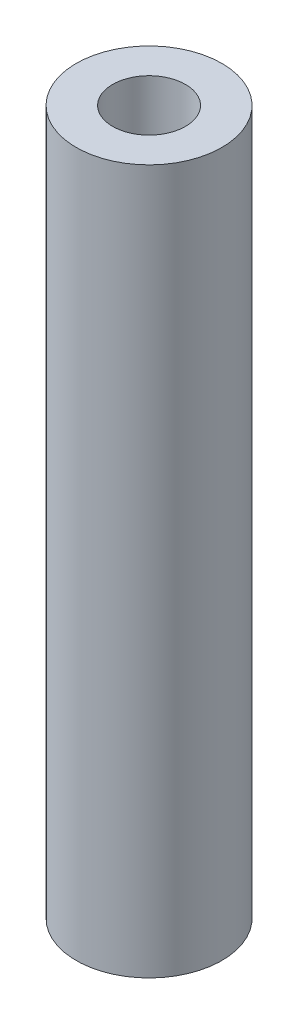
from build123d import *

# Parameters (mm, degrees)
SKETCH1_R      = 3
SKETCH1_R_2    = 1.5
STANDOFF_DEPTH = 29


with BuildPart() as part:
    # Sketch1 → standoff (new body)
    with BuildSketch(Plane(origin=(0, 0, 0), x_dir=(1, 0, 0), z_dir=(0, 1, 0))):
        with Locations(Location((0, 0, 0), (0, 0, 90))):
            Circle(SKETCH1_R)
        with Locations(Location((0, 0, 0), (0, 0, 90))):
            Circle(SKETCH1_R_2, mode=Mode.SUBTRACT)
    extrude(amount=STANDOFF_DEPTH)


solid = part.part
